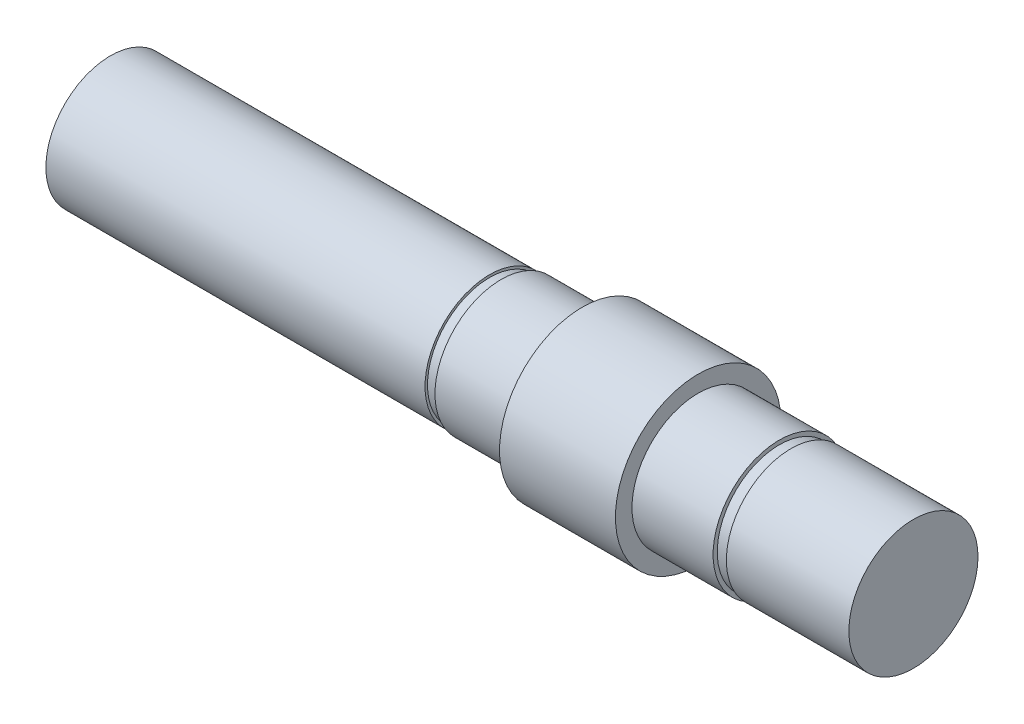
from build123d import *


with BuildPart() as part:
    # Sketch2 → Revolve1 (revolve)
    with BuildSketch(Plane.XY, mode=Mode.PRIVATE) as revolve1_sk:
        Polygon((128, -117.2), (123.1, -117.2), (123.1, -117.45), (122.4, -117.45), (122.4, -117.3), (115, -117.3), (99.5, -117.3), (99.5, -121.2), (108.5, -121.2), (115, -121.2), (148, -121.2), (148, -117.3), (140.6, -117.3), (140.6, -117.45), (139.9, -117.45), (139.9, -117.2), (135, -117.2), (135, -116.2), (128, -116.2), align=None)
    revolve(revolve1_sk.sketch.rotate(Axis((148, -121.2, 0), (-1, 0, 0)), 90), axis=Axis((148, -121.2, 0), (-1, 0, 0)))


solid = part.part
